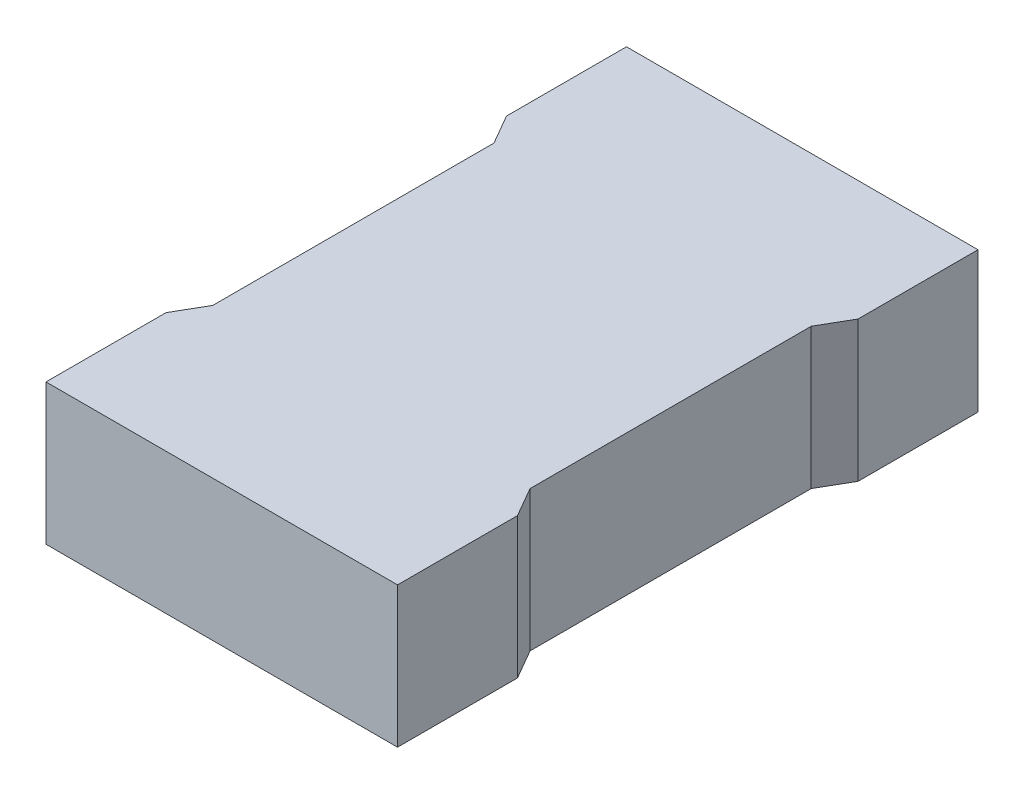
from build123d import *

# Parameters (mm, degrees)
BOSS_EXTRUDE2_DEPTH = 19.812


with BuildPart() as part:
    # Sketch2 → Boss-Extrude2 (new body)
    with BuildSketch(Plane(origin=(0, 0, 0), x_dir=(1, 0, 0), z_dir=(0, 1, 0))):
        Polygon((24.765, -40.894), (-24.765, -40.894), (-24.765, -23.991438599), (-22.352, -19.812), (-22.352, 19.812), (-24.765, 23.991438599), (-24.765, 40.894), (24.765, 40.894), (24.765, 23.991438599), (22.352, 19.812), (22.352, -19.812), (24.765, -23.991438599), align=None)
    extrude(amount=BOSS_EXTRUDE2_DEPTH)


solid = part.part
